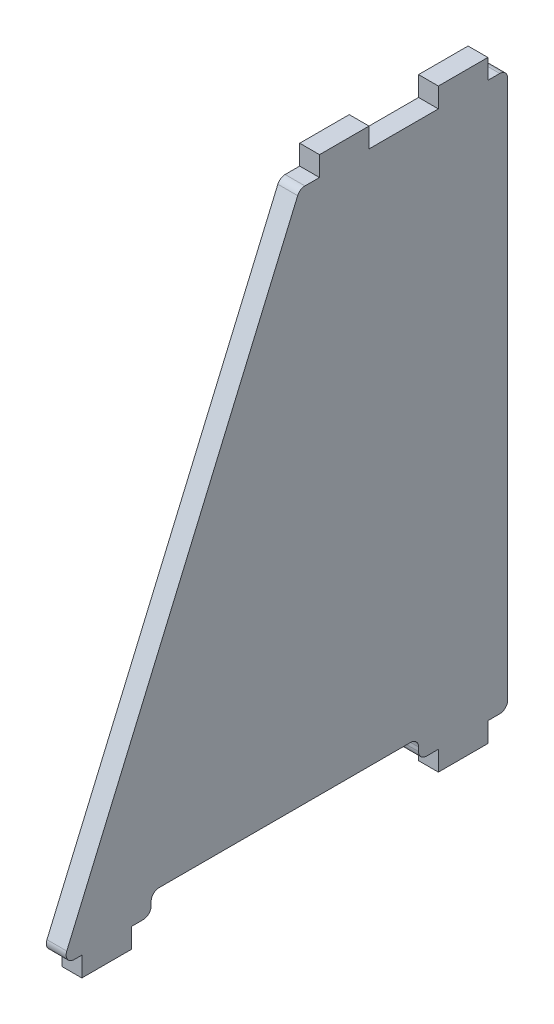
from build123d import *

# Parameters (mm, degrees)
SKETCH1_W           = 15.875
SKETCH1_H           = 6.35
BOSS_EXTRUDE1_DEPTH = 6.35
FILLET1_R           = 2.54


with BuildPart() as part:
    # Sketch1 → Boss-Extrude1 (new body)
    with BuildSketch(Plane(origin=(0, 0, 0), x_dir=(0, 0, -1), z_dir=(1, 0, 0))):
        Polygon((-26.9875, 88.9), (-33.3375, 88.9), (-109.5375, -88.9), (-103.1875, -88.9), (-87.3125, -88.9), (-80.9625, -88.9), (-80.9625, -82.55), (4.7625, -82.55), (4.7625, -88.9), (11.1125, -88.9), (26.9875, -88.9), (33.3375, -88.9), (33.3375, 88.9), (26.9875, 88.9), (11.1125, 88.9), (-11.1125, 88.9), align=None)
        with Locations((19.05, -92.075)):
            Rectangle(SKETCH1_W, SKETCH1_H)
        with Locations((-19.05, 92.075)):
            Rectangle(SKETCH1_W, SKETCH1_H)
        with Locations((19.05, 92.075)):
            Rectangle(SKETCH1_W, SKETCH1_H)
        with Locations((-95.25, -92.075)):
            Rectangle(SKETCH1_W, SKETCH1_H)
    extrude(amount=BOSS_EXTRUDE1_DEPTH)

    # Fillet1
    fillet1_edges = [part.edges().sort_by_distance(p)[0] for p in [
        (3.175, -82.55, 80.9625),
        (3.175, -88.9, 80.9625),
        (3.175, -88.9, 109.5375),
        (3.175, 88.9, 33.3375),
        (3.175, 88.9, -33.3375),
        (3.175, -88.9, -33.3375),
        (3.175, -88.9, -4.7625),
        (3.175, -82.55, -4.7625),
    ]]
    fillet(fillet1_edges, radius=FILLET1_R)


solid = part.part
